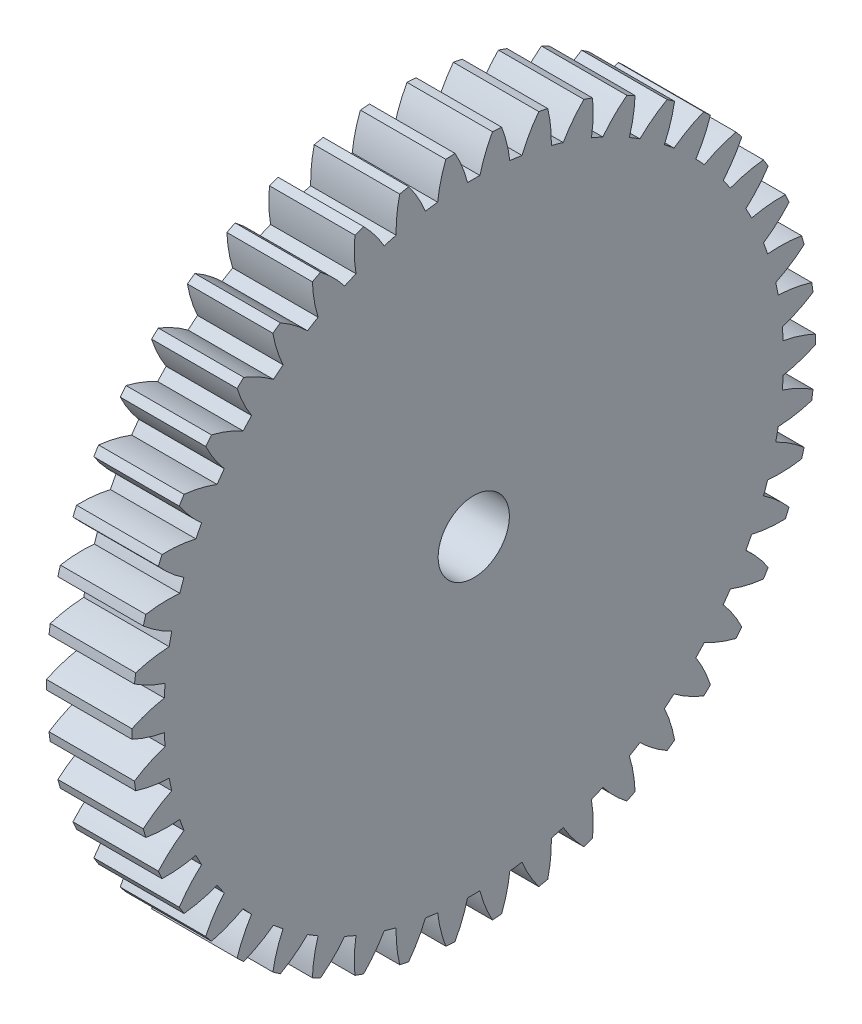
from build123d import *

# Parameters (mm, degrees)
BASPROSKE_W     = 12
BASPROSKE_H     = 48
TOOTHCUT_DEPTH  = 69.934751758
TEETHCUTS_COUNT = 46
TEETHCUTS_ANGLE = 352.173913043
BORSKE_R        = 5
BORE_DEPTH      = 50.0000508


with BuildPart() as part:
    # BasProSke → Base-Revolve (revolve)
    with BuildSketch(Plane(origin=(0, 0, 0), x_dir=(1, 0, 0), z_dir=(0, 1, 0)), mode=Mode.PRIVATE) as base_revolve_sk:
        with Locations((6, 24)):
            Rectangle(BASPROSKE_W, BASPROSKE_H)
    revolve(base_revolve_sk.sketch.rotate(Axis((-10, 0, 0), (1, 0, 0)), 180), axis=Axis((-10, 0, 0), (1, 0, 0)))

    # TooCutSke → ToothCut (cut, through all)
    with BuildSketch(Plane(origin=(0, 0, 0), x_dir=(0, 0, -1), z_dir=(1, 0, 0))):
        with BuildLine():
            ThreePointArc((0.868408384, 43.49033074), (0, 43.499), (-0.868408384, 43.49033074))
            ThreePointArc((-0.868408384, 43.49033074), (-1.611057718, 45.779645508), (-2.646160143, 47.952443959))
            ThreePointArc((-2.646160143, 47.952443959), (0, 48.0254), (2.646160143, 47.952443959))
            ThreePointArc((2.646160143, 47.952443959), (1.611057718, 45.779645508), (0.868408384, 43.49033074))
        make_face()
    toothcut = extrude(amount=TOOTHCUT_DEPTH, mode=Mode.SUBTRACT)

    # TeethCuts: ToothCut ×46 about axis
    teethcuts_axis = Axis((-10, 0, 0), (1, 0, 0))
    for i in range(1, TEETHCUTS_COUNT):
        add(toothcut.rotate(teethcuts_axis, i * TEETHCUTS_ANGLE / (TEETHCUTS_COUNT - 1)), mode=Mode.SUBTRACT)

    # BorSke → Bore (cut, symmetric)
    with BuildSketch(Plane(origin=(0, 0, 0), x_dir=(0, 0, -1), z_dir=(1, 0, 0))):
        with Locations(Location((0, 0, 0), (0, 0, 180))):
            Circle(BORSKE_R)
    extrude(amount=BORE_DEPTH, both=True, mode=Mode.SUBTRACT)


solid = part.part
